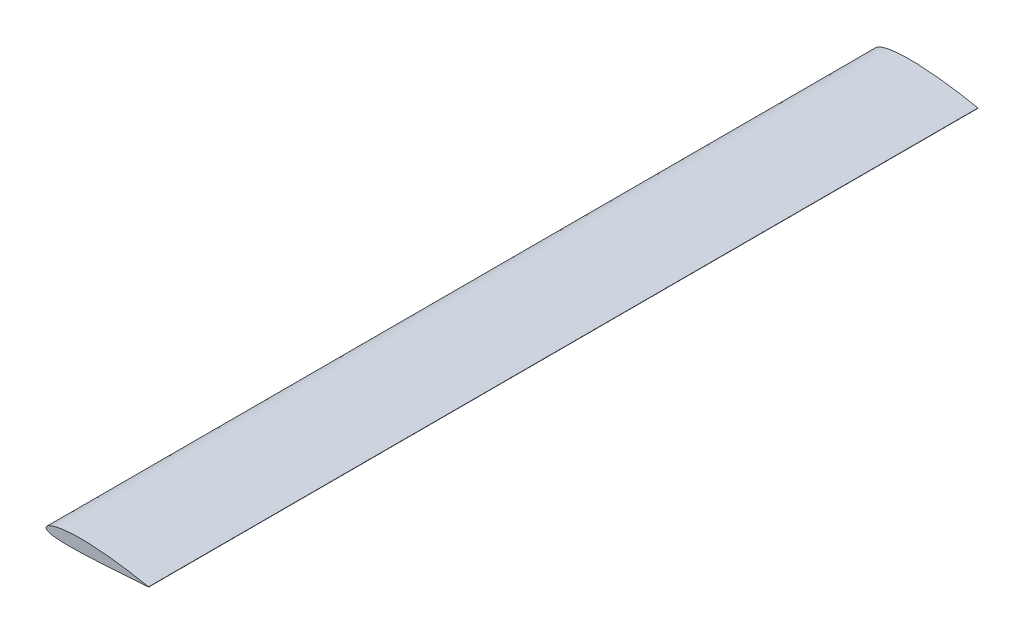
from build123d import *

# Parameters (mm, degrees)
BOSS_EXTRUDE2_DEPTH = 1415


with BuildPart() as part:
    # Sketch3 → Boss-Extrude2 (new body)
    with BuildSketch(Plane.XY):
        with BuildLine():
            Line((350, 0.455), (350, -0.455))
            add(Edge.make_bspline(
                [(350, 0.455), (344.169902064, 1.649666762), (332.525018486, 4.035862589), (309.215253326, 8.406509223), (280.062345555, 13.249189299), (245.055704656, 18.261245075), (210.054838401, 22.44111439), (175.038797911, 25.501677266), (140.030731771, 27.574280077), (110.822441983, 27.925109808), (87.478831386, 26.958710008), (69.956807941, 25.542655037), (52.41266314, 23.300239865), (37.811572407, 20.538879037), (26.17129633, 17.414802949), (17.346323137, 14.574555653), (9.869381631, 11.265240958), (3.419839485, 7.253062959), (-2.204380137, 0.314569913), (3.637685542, -5.784240231), (9.966590405, -8.565853643), (17.410637287, -10.678784067), (26.206556219, -12.193760888), (37.893418962, -13.486624851), (52.481460922, -14.481725501), (69.997939225, -14.880690665), (87.501916013, -14.825093528), (110.837411434, -14.309999235), (140.009503708, -13.383116795), (175.011686204, -11.770060453), (210.00371914, -9.67348796), (245.001687049, -7.494268702), (280.005639007, -5.288428196), (309.166001398, -3.256858759), (332.501484146, -1.689872068), (344.166894349, -0.866642867), (350, -0.455)],
                knots=[0, 0, 0, 0, 0.02501249, 0.049959286, 0.099672925, 0.14920632, 0.198581097, 0.24780517, 0.296916575, 0.345952722, 0.370491626, 0.395091204, 0.419814796, 0.444798575, 0.457489819, 0.470406405, 0.483879409, 0.49126412, 0.503458853, 0.513609129, 0.520450991, 0.533235388, 0.545691039, 0.558031884, 0.582609167, 0.607134742, 0.63165208, 0.656174272, 0.705233949, 0.754320379, 0.803437364, 0.852566096, 0.901700994, 0.950848809, 0.975422717, 1, 1, 1, 1], degree=3))
        make_face()
    boss_extrude2 = extrude(amount=BOSS_EXTRUDE2_DEPTH)

    # Mirror1: Boss-Extrude2 across plane
    add(boss_extrude2.mirror(Plane(origin=(0.325471061, 2.299520855, 0), x_dir=(1, 0, 0), z_dir=(0, 0, -1))))


solid = part.part
